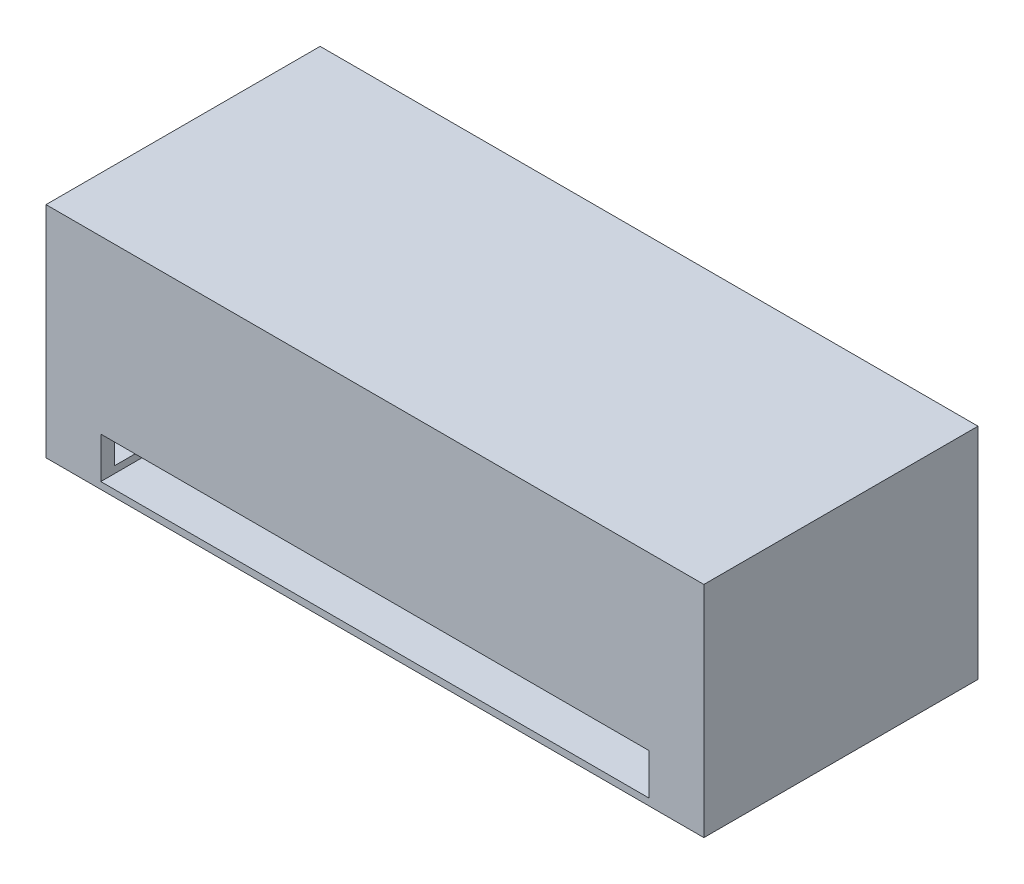
from build123d import *

# Parameters (mm, degrees)
SKETCH1_W               = 304.8
SKETCH1_H               = 127
BOSS_EXTRUDE1_DEPTH     = 101.6
SHELL1_T                = 6.35
CUT_EXTRUDE1_DEPTH      = 223.88409544
CUT_EXTRUDE1_DEPTH_BACK = 223.88409544
SKETCH2_W               = 254
SKETCH2_H               = 19.05


with BuildPart() as part:
    # Sketch1 → Boss-Extrude1 (new body)
    with BuildSketch(Plane(origin=(0, 0, 0), x_dir=(1, 0, 0), z_dir=(0, 1, 0))):
        Rectangle(SKETCH1_W, SKETCH1_H)
    extrude(amount=BOSS_EXTRUDE1_DEPTH)

    # Shell1 (no face opened: a closed hollow body)
    add(offset(amount=-SHELL1_T, mode=Mode.PRIVATE), mode=Mode.SUBTRACT)

    # Sketch2 → Cut-Extrude1 (cut, two sides: drawn at the far end of the back side and taken through both)
    with BuildSketch(Plane.XY.offset(63.5).offset(-CUT_EXTRUDE1_DEPTH_BACK)):
        with Locations((0, 12.7)):
            Rectangle(SKETCH2_W, SKETCH2_H)
    extrude(amount=CUT_EXTRUDE1_DEPTH + CUT_EXTRUDE1_DEPTH_BACK, mode=Mode.SUBTRACT)


solid = part.part
